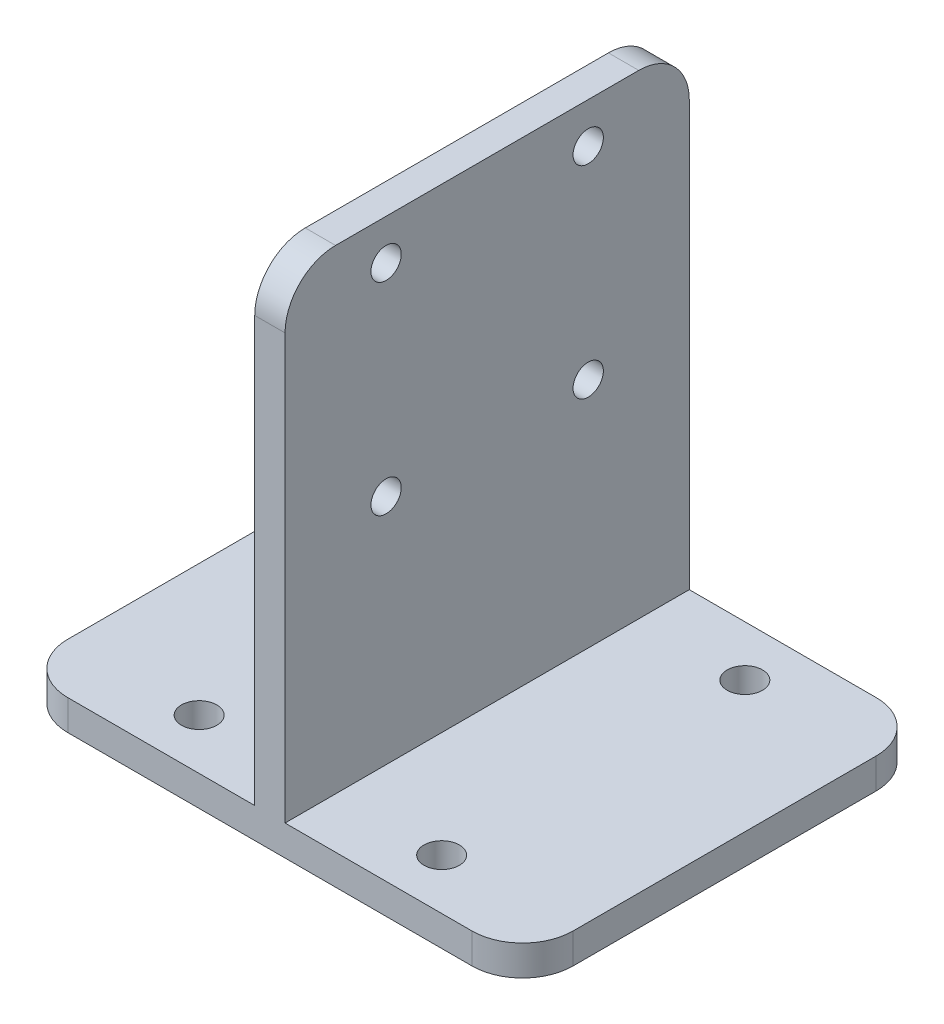
from build123d import *

# Parameters (mm, degrees)
SKETCH_1_W          = 50
SKETCH_1_H          = 40
SKETCH_1_R          = 1.75
EXTRUDE_1_DEPTH     = 3
FILLET_1_R          = 5
SKETCH_2_W          = 3
SKETCH_2_H          = 40
EXTRUDE_2_DEPTH     = 47
CUT_EXTRUDE_1_REACH = 62.019
SKETCH_3_R          = 1.5
FILLET_2_R          = 5


with BuildPart() as part:
    # 草图1 → 凸台-拉伸1 (new body)
    with BuildSketch(Plane(origin=(0, 0, 0), x_dir=(1, 0, 0), z_dir=(0, 1, 0))):
        Rectangle(SKETCH_1_W, SKETCH_1_H)
        with Locations(Location((-12, 15, 0), (0, 0, 270))):
            Circle(SKETCH_1_R, mode=Mode.SUBTRACT)
        with Locations(Location((12, 15, 0), (0, 0, 270))):
            Circle(SKETCH_1_R, mode=Mode.SUBTRACT)
        with Locations(Location((12, -15, 0), (0, 0, 270))):
            Circle(SKETCH_1_R, mode=Mode.SUBTRACT)
        with Locations(Location((-12, -15, 0), (0, 0, 270))):
            Circle(SKETCH_1_R, mode=Mode.SUBTRACT)
    extrude(amount=EXTRUDE_1_DEPTH)

    # 圆角1
    fillet_1_edges = [part.edges().sort_by_distance(p)[0] for p in [
        (25, 1.5, 20),
        (-25, 1.5, 20),
        (-25, 1.5, -20),
        (25, 1.5, -20),
    ]]
    fillet(fillet_1_edges, radius=FILLET_1_R)

    # 草图2 → 凸台-拉伸2 (add)
    with BuildSketch(Plane(origin=(0, 3, 0), x_dir=(1, 0, 0), z_dir=(0, 1, 0))):
        Rectangle(SKETCH_2_W, SKETCH_2_H)
    extrude(amount=EXTRUDE_2_DEPTH)

    # 草图3 → 切除-拉伸1 (cut, up to next)
    with BuildSketch(Plane.ZY.offset(1.5), mode=Mode.PRIVATE) as cut_extrude_1_sk1:
        with Locations((-10, 46)):
            Circle(SKETCH_3_R)
    cut_extrude_1_tool1 = extrude(cut_extrude_1_sk1.sketch, amount=-CUT_EXTRUDE_1_REACH, mode=Mode.PRIVATE) & part.part
    # 草图3 → 切除-拉伸1 (cut, up to next)
    with BuildSketch(Plane.ZY.offset(1.5), mode=Mode.PRIVATE) as cut_extrude_1_sk2:
        with Locations((10, 46)):
            Circle(SKETCH_3_R)
    cut_extrude_1_tool2 = extrude(cut_extrude_1_sk2.sketch, amount=-CUT_EXTRUDE_1_REACH, mode=Mode.PRIVATE) & part.part
    # 草图3 → 切除-拉伸1 (cut, up to next)
    with BuildSketch(Plane.ZY.offset(1.5), mode=Mode.PRIVATE) as cut_extrude_1_sk3:
        with Locations((10, 26)):
            Circle(SKETCH_3_R)
    cut_extrude_1_tool3 = extrude(cut_extrude_1_sk3.sketch, amount=-CUT_EXTRUDE_1_REACH, mode=Mode.PRIVATE) & part.part
    # 草图3 → 切除-拉伸1 (cut, up to next)
    with BuildSketch(Plane.ZY.offset(1.5), mode=Mode.PRIVATE) as cut_extrude_1_sk4:
        with Locations((-10, 26)):
            Circle(SKETCH_3_R)
    cut_extrude_1_tool4 = extrude(cut_extrude_1_sk4.sketch, amount=-CUT_EXTRUDE_1_REACH, mode=Mode.PRIVATE) & part.part
    add(cut_extrude_1_tool1.solids().sort_by_distance((-1.5, 46, -10))[0], mode=Mode.SUBTRACT)
    add(cut_extrude_1_tool2.solids().sort_by_distance((-1.5, 46, 10))[0], mode=Mode.SUBTRACT)
    add(cut_extrude_1_tool3.solids().sort_by_distance((-1.5, 26, 10))[0], mode=Mode.SUBTRACT)
    add(cut_extrude_1_tool4.solids().sort_by_distance((-1.5, 26, -10))[0], mode=Mode.SUBTRACT)

    # 圆角2
    fillet_2_edges = [part.edges().sort_by_distance(p)[0] for p in [
        (0, 50, -20),
        (0, 50, 20),
    ]]
    fillet(fillet_2_edges, radius=FILLET_2_R)


solid = part.part
